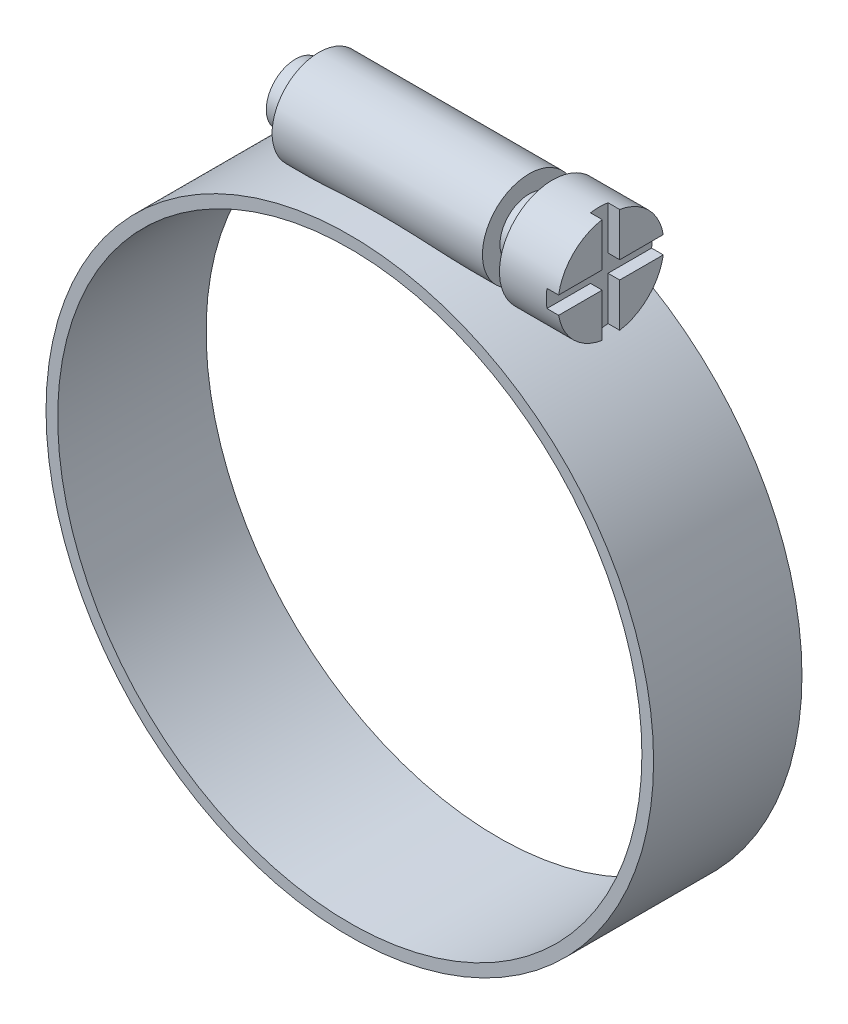
from build123d import *

# Parameters (mm, degrees)
SKETCH1_W                = 12.7
SKETCH1_H                = 1
SKETCH2_R                = 4
BOSS_EXTRUDE1_DEPTH      = 9
BOSS_EXTRUDE2_DEPTH      = 2
BOSS_EXTRUDE2_DEPTH_BACK = 20
SKETCH3_R                = 2.5
SKETCH4_R                = 4.540800692
BOSS_EXTRUDE3_DEPTH      = 5
CUT_EXTRUDE1_DEPTH       = 1


with BuildPart() as part:
    # Sketch1 → Revolve1 (revolve)
    with BuildSketch(Plane(origin=(0, 0, 0), x_dir=(0, 0, -1), z_dir=(1, 0, 0)), mode=Mode.PRIVATE) as revolve1_sk:
        with Locations((0, 25.5)):
            Rectangle(SKETCH1_W, SKETCH1_H)
    revolve(revolve1_sk.sketch.rotate(Axis((0, 0, 0), (0, 0, -1)), 90), axis=Axis((0, 0, 0), (0, 0, -1)))

    # Sketch2 → Boss-Extrude1 (add, symmetric)
    with BuildSketch(Plane(origin=(0, 0, 0), x_dir=(0, 0, -1), z_dir=(1, 0, 0))):
        with Locations((0, 27.867620805)):
            Circle(SKETCH2_R)
    extrude(amount=BOSS_EXTRUDE1_DEPTH, both=True)

    # Sketch3 → Boss-Extrude2 (add, two sides: drawn at the far end of the back side and taken through both)
    with BuildSketch(Plane(origin=(9, 0, 0), x_dir=(0, 0, -1), z_dir=(1, 0, 0)).offset(-BOSS_EXTRUDE2_DEPTH_BACK)):
        with Locations((0, 27.867620805)):
            Circle(SKETCH3_R)
    extrude(amount=BOSS_EXTRUDE2_DEPTH + BOSS_EXTRUDE2_DEPTH_BACK)

    # Sketch4 → Boss-Extrude3 (add)
    with BuildSketch(Plane(origin=(11, 0, 0), x_dir=(0, 0, -1), z_dir=(1, 0, 0))):
        with Locations(Location((0, 27.867620805, 0), (0, 0, 251.621037372))):
            Circle(SKETCH4_R)
    extrude(amount=BOSS_EXTRUDE3_DEPTH)

    # Sketch5 → Cut-Extrude1 (cut)
    with BuildSketch(Plane(origin=(16, 0, 0), x_dir=(0, 0, -1), z_dir=(1, 0, 0))):
        Polygon((0.75, 27.117620805), (5.588794468, 27.117620805), (5.588794468, 28.617620805), (0.75, 28.617620805), (0.75, 32.881878849), (-0.75, 32.881878849), (-0.75, 28.617620805), (-5.588794468, 28.617620805), (-5.588794468, 27.117620805), (-0.75, 27.117620805), (-0.75, 22.853362761), (0.75, 22.853362761), align=None)
    extrude(amount=-CUT_EXTRUDE1_DEPTH, mode=Mode.SUBTRACT)


solid = part.part
